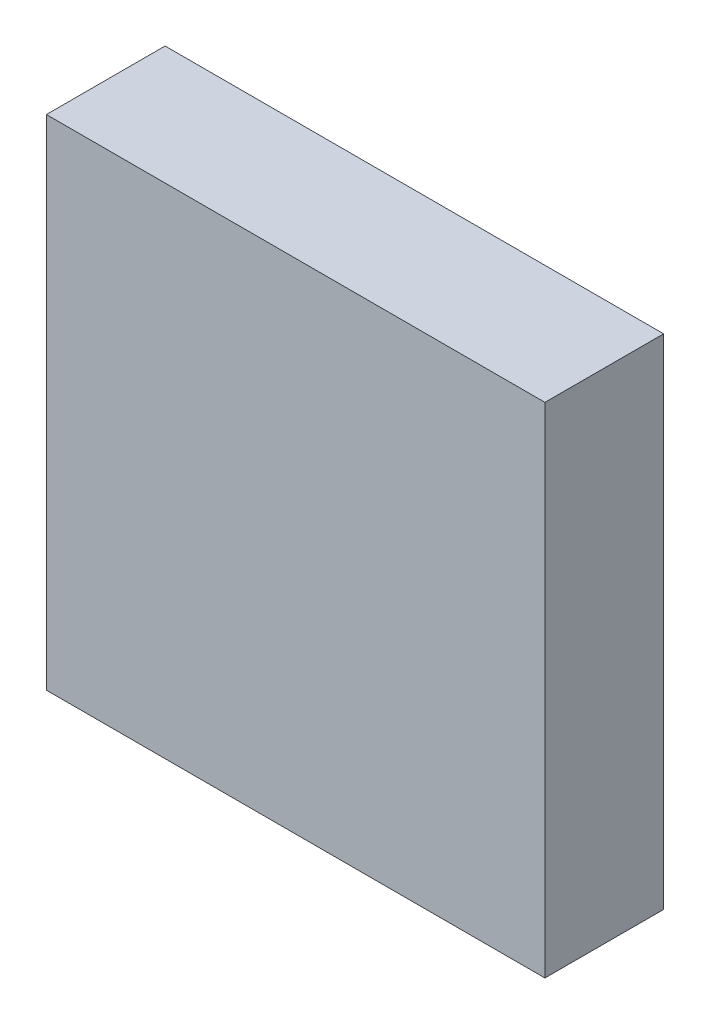
from build123d import *

# Parameters (mm, degrees)
SKETCH1_W           = 2100
SKETCH1_H           = 2100
SKETCH1_W_2         = 2000
SKETCH1_H_2         = 2000
BOSS_EXTRUDE1_DEPTH = 500
SKETCH2_W           = 2100
SKETCH2_H           = 2100
BOSS_EXTRUDE2_DEPTH = 10


with BuildPart() as part:
    # Sketch1 → Boss-Extrude1 (new body)
    with BuildSketch(Plane.XY):
        Rectangle(SKETCH1_W, SKETCH1_H)
        Rectangle(SKETCH1_W_2, SKETCH1_H_2, mode=Mode.SUBTRACT)
    extrude(amount=BOSS_EXTRUDE1_DEPTH)

    # Sketch2 → Boss-Extrude2 (add)
    with BuildSketch(Plane.XY.offset(500)):
        Rectangle(SKETCH2_W, SKETCH2_H)
    extrude(amount=-BOSS_EXTRUDE2_DEPTH)


solid = part.part
